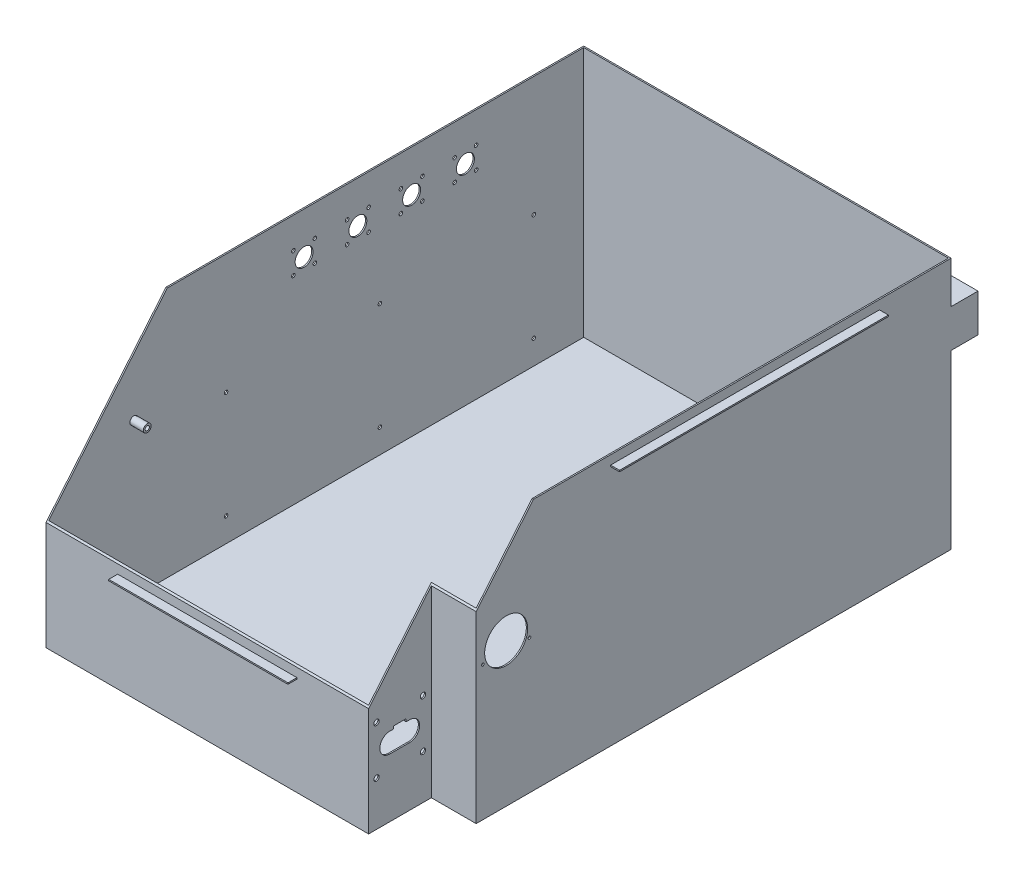
from build123d import *

# Parameters (mm, degrees)
BOSS_EXTRUDE1_DEPTH     = 1.5
BOSS_EXTRUDE2_DEPTH     = 280
SKETCH4_W               = 410
SKETCH4_H               = 42.385541564
BOSS_EXTRUDE3_DEPTH     = 30
CUT_EXTRUDE1_DEPTH      = 616.233320702
CUT_EXTRUDE1_DEPTH_BACK = 616.233320702
SKETCH8_R               = 4.39
SKETCH8_R_2             = 2.39
BOSS_EXTRUDE5_DEPTH     = 15
SKETCH10_R              = 3
CUT_EXTRUDE2_DEPTH      = 1.5
SKETCH15_W              = 15
SKETCH15_H              = 1.5
SKETCH15_W_2            = 20
BOSS_EXTRUDE6_DEPTH     = 13
BOSS_EXTRUDE7_DEPTH     = 1.5
BOSS_EXTRUDE8_DEPTH     = 1.5
SKETCH20_R              = 2.415919743
SKETCH20_R_2            = 2
CUT_EXTRUDE5_DEPTH      = 1.5
SKETCH5_R               = 2
SKETCH5_R_2             = 10
CUT_EXTRUDE7_DEPTH      = 1.5
SKETCH21_W              = 300
SKETCH21_H              = 1.5
BOSS_EXTRUDE9_DEPTH     = 10
SKETCH22_W              = 300
SKETCH22_H              = 1.5
BOSS_EXTRUDE10_DEPTH    = 10
BOSS_EXTRUDE11_DEPTH    = 0.75
BOSS_EXTRUDE12_DEPTH    = 0.75
BOSS_EXTRUDE13_DEPTH    = 0.75
BOSS_EXTRUDE14_DEPTH    = 0.75
SKETCH27_W              = 200
SKETCH27_H              = 1.5
BOSS_EXTRUDE15_DEPTH    = 10
BOSS_EXTRUDE16_DEPTH    = 0.75
BOSS_EXTRUDE17_DEPTH    = 0.75
SKETCH30_R              = 24
SKETCH30_R_2            = 1.5
CUT_EXTRUDE8_DEPTH      = 1.5
SKETCH33_R              = 2
CUT_EXTRUDE9_DEPTH      = 1.5


with BuildPart() as part:
    # Sketch1 → Boss-Extrude1 (new body)
    with BuildSketch(Plane(origin=(0, 0, 0), x_dir=(1, 0, 0), z_dir=(0, 1, 0))):
        Polygon((-205, 237.826300096), (205, 237.826300096), (205, -292.173699904), (155, -292.173699904), (155, -362.173699904), (-205, -362.173699904), align=None)
    extrude(amount=BOSS_EXTRUDE1_DEPTH)

    # Sketch2 → Boss-Extrude2 (add)
    with BuildSketch(Plane(origin=(0, 1.5, 0), x_dir=(1, 0, 0), z_dir=(0, 1, 0))):
        Polygon((-205, 237.826300096), (-205, -362.173699904), (155, -362.173699904), (155, -292.173699904), (205, -292.173699904), (205, 237.826300096), align=None)
        Polygon((-203.5, 236.326300096), (-203.5, -360.673699904), (153.5, -360.673699904), (153.5, -290.673699904), (203.5, -290.673699904), (203.5, 236.326300096), align=None, mode=Mode.SUBTRACT)
    extrude(amount=BOSS_EXTRUDE2_DEPTH)

    # Sketch4 → Boss-Extrude3 (add)
    with BuildSketch(Plane(origin=(0, 0, -237.826300096), x_dir=(-1, 0, 0), z_dir=(0, 0, -1))):
        with Locations((0, 213.483316708)):
            Rectangle(SKETCH4_W, SKETCH4_H)
    extrude(amount=BOSS_EXTRUDE3_DEPTH)

    # Sketch3 → Cut-Extrude1 (cut, two sides: drawn at the far end of the back side and taken through both)
    with BuildSketch(Plane.ZY.offset(205).offset(-CUT_EXTRUDE1_DEPTH_BACK)):
        Polygon((362.173699904, 121.117558148), (228.195222706, 281.5), (362.173699904, 281.5), align=None)
    extrude(amount=CUT_EXTRUDE1_DEPTH + CUT_EXTRUDE1_DEPTH_BACK, mode=Mode.SUBTRACT)

    # Sketch8 → Boss-Extrude5 (add)
    # profile 1 of 2: a face of its own
    with BuildSketch(Plane(origin=(-203.5, 0, 0), x_dir=(0, 0, -1), z_dir=(1, 0, 0))):
        with Locations((-265.673699904, 172.2)):
            Circle(SKETCH8_R)
        with Locations((-265.673699904, 172.2)):
            Circle(SKETCH8_R_2, mode=Mode.SUBTRACT)
    # profile 2 of 2: a face of its own
    with BuildSketch(Plane(origin=(-203.5, 0, 0), x_dir=(0, 0, -1), z_dir=(1, 0, 0))):
        with Locations((-265.673699904, 16.5)):
            Circle(SKETCH8_R)
        with Locations((-265.673699904, 16.5)):
            Circle(SKETCH8_R_2, mode=Mode.SUBTRACT)
    extrude(amount=BOSS_EXTRUDE5_DEPTH)

    # Sketch10 → Cut-Extrude2 (cut)
    with BuildSketch(Plane.ZY.offset(-153.5)):
        with BuildLine():
            Line((334.423699904, 90.5), (320.423699904, 90.5))
            Line((320.423699904, 90.5), (320.423699904, 87.5))
            Line((320.423699904, 87.5), (316.173699904, 87.5))
            ThreePointArc((316.173699904, 87.5), (305.173699904, 76.5), (316.173699904, 65.5))
            Line((316.173699904, 65.5), (338.673699904, 65.5))
            ThreePointArc((338.673699904, 65.5), (349.673699904, 76.5), (338.673699904, 87.5))
            Line((338.673699904, 87.5), (334.423699904, 87.5))
            Line((334.423699904, 87.5), (334.423699904, 90.5))
        make_face()
        with Locations((301.473699904, 103.45)):
            Circle(SKETCH10_R)
        with Locations((353.373699904, 103.45)):
            Circle(SKETCH10_R)
        with Locations((301.473699904, 49.55)):
            Circle(SKETCH10_R)
        with Locations((353.373699904, 49.55)):
            Circle(SKETCH10_R)
    extrude(amount=-CUT_EXTRUDE2_DEPTH, mode=Mode.SUBTRACT)

    # Sketch15 → Boss-Extrude6 (add)
    with BuildSketch(Plane.ZY.offset(-203.5)):
        with Locations((-143.826300096, 251.386283415)):
            Rectangle(SKETCH15_W, SKETCH15_H)
        with Locations((136.673699904, 251.386283415)):
            Rectangle(SKETCH15_W_2, SKETCH15_H)
    extrude(amount=BOSS_EXTRUDE6_DEPTH)

    # Sketch17 → Boss-Extrude7 (add)
    with BuildSketch(Plane.XY.offset(-136.326300096)):
        Polygon((203.5, 250.636283415), (203.5, 235.636283415), (190.5, 250.636283415), align=None)
    extrude(amount=-BOSS_EXTRUDE7_DEPTH)

    # Sketch18 → Boss-Extrude8 (add)
    with BuildSketch(Plane.XY.offset(126.673699904)):
        Polygon((203.5, 250.636283415), (203.5, 235.636283415), (190.5, 250.636283415), align=None)
    extrude(amount=BOSS_EXTRUDE8_DEPTH)

    # Sketch20 → Cut-Extrude5 (cut)
    with BuildSketch(Plane(origin=(0, 252.136283415, 0), x_dir=(1, 0, 0), z_dir=(0, 1, 0))):
        with Locations(Location((198, 144.326300096, 0), (0, 0, 270))):
            Circle(SKETCH20_R)
        with Locations(Location((200.5, -139.673699904, 0), (0, 0, 270))):
            Circle(SKETCH20_R_2)
    extrude(amount=-CUT_EXTRUDE5_DEPTH, mode=Mode.SUBTRACT)

    # Sketch5 → Cut-Extrude7 (cut)
    with BuildSketch(Plane.ZY.offset(205)):
        with Locations((-116.326300096, 247.125857706)):
            Circle(SKETCH5_R)
        with Locations((-116.326300096, 223.125857706)):
            Circle(SKETCH5_R)
        with Locations((-92.326300096, 223.125857706)):
            Circle(SKETCH5_R)
        with Locations((-92.326300096, 247.125857706)):
            Circle(SKETCH5_R)
        with Locations((-104.326300096, 235.125857706)):
            Circle(SKETCH5_R_2)
        with Locations((-56.326300096, 247.125857706)):
            Circle(SKETCH5_R)
        with Locations((-56.326300096, 223.125857706)):
            Circle(SKETCH5_R)
        with Locations((-32.326300096, 223.125857706)):
            Circle(SKETCH5_R)
        with Locations((-32.326300096, 247.125857706)):
            Circle(SKETCH5_R)
        with Locations((-44.326300096, 235.125857706)):
            Circle(SKETCH5_R_2)
        with Locations((3.673699904, 247.125857706)):
            Circle(SKETCH5_R)
        with Locations((3.673699904, 223.125857706)):
            Circle(SKETCH5_R)
        with Locations((27.673699904, 223.125857706)):
            Circle(SKETCH5_R)
        with Locations((27.673699904, 247.125857706)):
            Circle(SKETCH5_R)
        with Locations((15.673699904, 235.125857706)):
            Circle(SKETCH5_R_2)
        with Locations((63.673699904, 247.125857706)):
            Circle(SKETCH5_R)
        with Locations((63.673699904, 223.125857706)):
            Circle(SKETCH5_R)
        with Locations((87.673699904, 223.125857706)):
            Circle(SKETCH5_R)
        with Locations((87.673699904, 247.125857706)):
            Circle(SKETCH5_R)
        with Locations((75.673699904, 235.125857706)):
            Circle(SKETCH5_R_2)
    extrude(amount=-CUT_EXTRUDE7_DEPTH, mode=Mode.SUBTRACT)

    # Sketch21 → Boss-Extrude9 (add)
    with BuildSketch(Plane(origin=(0, 0, -237.826300096), x_dir=(-1, 0, 0), z_dir=(0, 0, -1))):
        with Locations((0, 270.75)):
            Rectangle(SKETCH21_W, SKETCH21_H)
    extrude(amount=BOSS_EXTRUDE9_DEPTH)

    # Sketch22 → Boss-Extrude10 (add)
    with BuildSketch(Plane.ZY.offset(205)):
        with Locations((-7.826300096, 270.75)):
            Rectangle(SKETCH22_W, SKETCH22_H)
    boss_extrude10 = extrude(amount=BOSS_EXTRUDE10_DEPTH)

    # Sketch23 → Boss-Extrude11 (add, symmetric)
    with BuildSketch(Plane(origin=(0, 0, -77.826300096), x_dir=(-1, 0, 0), z_dir=(0, 0, -1))):
        Polygon((215, 270), (205, 270), (205, 260), align=None)
    boss_extrude11 = extrude(amount=BOSS_EXTRUDE11_DEPTH, both=True)

    # Sketch24 → Boss-Extrude12 (add, symmetric)
    with BuildSketch(Plane.XY.offset(52.173699904)):
        Polygon((-215, 270), (-205, 260), (-205, 270), align=None)
    boss_extrude12 = extrude(amount=BOSS_EXTRUDE12_DEPTH, both=True)

    # Sketch25 → Boss-Extrude13 (add, symmetric)
    with BuildSketch(Plane(origin=(100, 0, 0), x_dir=(0, 0, -1), z_dir=(1, 0, 0))):
        Polygon((247.826300096, 270), (237.826300096, 270), (237.826300096, 260), align=None)
    extrude(amount=BOSS_EXTRUDE13_DEPTH, both=True)

    # Sketch26 → Boss-Extrude14 (add, symmetric)
    with BuildSketch(Plane.ZY.offset(100)):
        Polygon((-247.826300096, 270), (-237.826300096, 260), (-237.826300096, 270), align=None)
    extrude(amount=BOSS_EXTRUDE14_DEPTH, both=True)

    # Mirror1: Boss-Extrude10, Boss-Extrude11, Boss-Extrude12 across plane
    add(boss_extrude10.mirror(Plane(origin=(0, 0, 0), x_dir=(0, 0, 1), z_dir=(1, 0, 0))))
    add(boss_extrude11.mirror(Plane(origin=(0, 0, 0), x_dir=(0, 0, 1), z_dir=(1, 0, 0))))
    add(boss_extrude12.mirror(Plane(origin=(0, 0, 0), x_dir=(0, 0, 1), z_dir=(1, 0, 0))))

    # Sketch27 → Boss-Extrude15 (add)
    with BuildSketch(Plane.XY.offset(362.173699904)):
        with Locations((-25, 110.367558148)):
            Rectangle(SKETCH27_W, SKETCH27_H)
    extrude(amount=BOSS_EXTRUDE15_DEPTH)

    # Sketch28 → Boss-Extrude16 (add, symmetric)
    with BuildSketch(Plane.ZY.offset(95)):
        Polygon((372.173699904, 109.617558148), (362.173699904, 109.617558148), (362.173699904, 99.617558148), align=None)
    extrude(amount=BOSS_EXTRUDE16_DEPTH, both=True)

    # Sketch29 → Boss-Extrude17 (add, symmetric)
    with BuildSketch(Plane(origin=(45, 0, 0), x_dir=(0, 0, -1), z_dir=(1, 0, 0))):
        Polygon((-372.173699904, 109.617558148), (-362.173699904, 99.617558148), (-362.173699904, 109.617558148), align=None)
    extrude(amount=BOSS_EXTRUDE17_DEPTH, both=True)

    # Sketch30 → Cut-Extrude8 (cut)
    with BuildSketch(Plane(origin=(205, 0, 0), x_dir=(0, 0, -1), z_dir=(1, 0, 0))):
        with Locations((-258.673699904, 160)):
            Circle(SKETCH30_R)
        with Locations((-284.673699904, 150)):
            Circle(SKETCH30_R_2)
        with Locations((-232.673699904, 150)):
            Circle(SKETCH30_R_2)
    extrude(amount=-CUT_EXTRUDE8_DEPTH, mode=Mode.SUBTRACT)

    # Sketch33 → Cut-Extrude9 (cut)
    with BuildSketch(Plane.ZY.offset(205)):
        with Locations((-180.626300096, 147.77)):
            Circle(SKETCH33_R)
        with Locations((-180.626300096, 28.39)):
            Circle(SKETCH33_R)
        with Locations((-8.926300096, 147.77)):
            Circle(SKETCH33_R)
        with Locations((-8.926300096, 28.39)):
            Circle(SKETCH33_R)
        with Locations((162.773699904, 147.77)):
            Circle(SKETCH33_R)
        with Locations((162.773699904, 28.39)):
            Circle(SKETCH33_R)
    extrude(amount=-CUT_EXTRUDE9_DEPTH, mode=Mode.SUBTRACT)


solid = part.part
